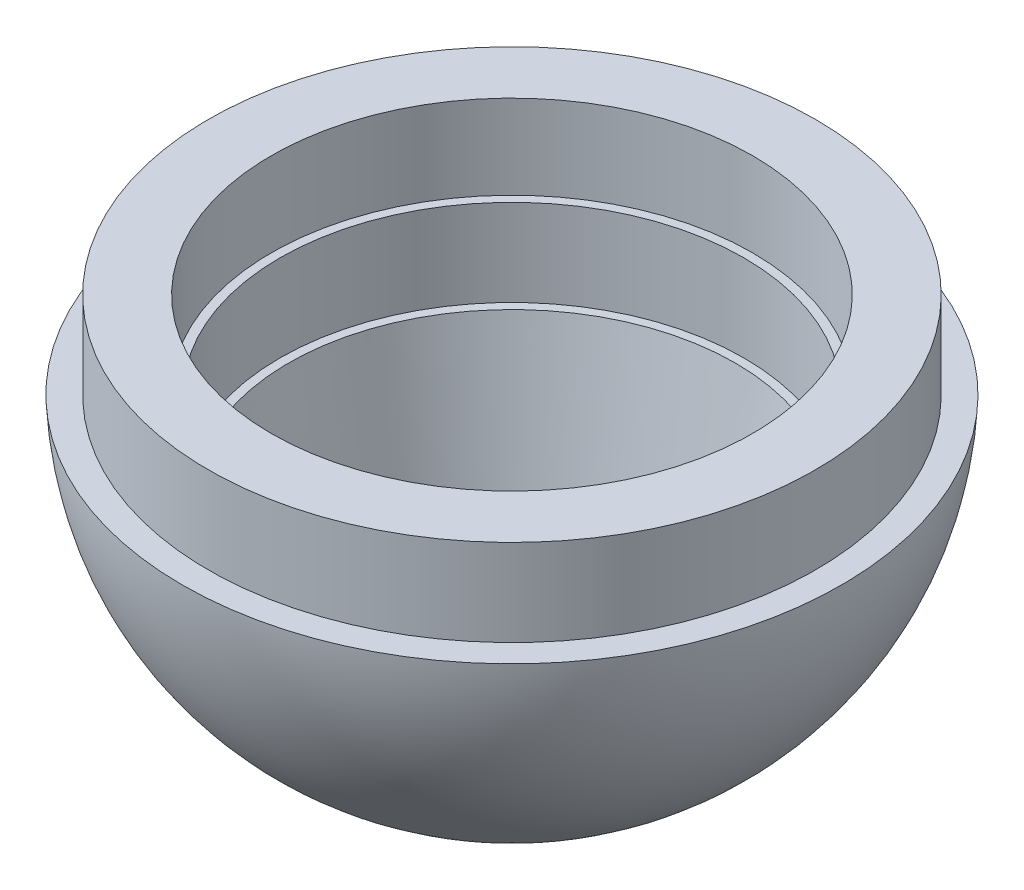
from build123d import *


with BuildPart() as part:
    # Sketch1 → Revolve1 (revolve)
    with BuildSketch(Plane(origin=(0, 0, 0), x_dir=(0, 0, -1), z_dir=(1, 0, 0)), mode=Mode.PRIVATE) as revolve1_sk:
        with BuildLine():
            Line((-27.75, 0), (-27.75, -1.5))
            Line((-27.75, -1.5), (-26.75, -1.5))
            Line((-26.75, -1.5), (-26.75, -11.5))
            Line((-26.75, -11.5), (-25.75, -11.5))
            Line((-25.75, -11.5), (-22.796999799, -28.247296355))
            ThreePointArc((-22.796999799, -28.247296355), (-22.112959512, -29.432088886), (-20.827384293, -29.9))
            Line((-20.827384293, -29.9), (0, -29.9))
            Line((0, -29.9), (0, -32.4))
            Line((0, -32.4), (-19.936900461, -32.4))
            ThreePointArc((-19.936900461, -32.4), (-32.760664046, -19.338533844), (-38, -1.8))
            Line((-38, -1.8), (-35, -1.8))
            Line((-35, -1.8), (-35, 8.2))
            Line((-35, 8.2), (-27.75, 8.2))
            Line((-27.75, 8.2), (-27.75, 0))
        make_face()
    revolve(revolve1_sk.sketch.rotate(Axis((0, 0, 0), (0, 1, 0)), 180), axis=Axis((0, 0, 0), (0, 1, 0)))


solid = part.part
